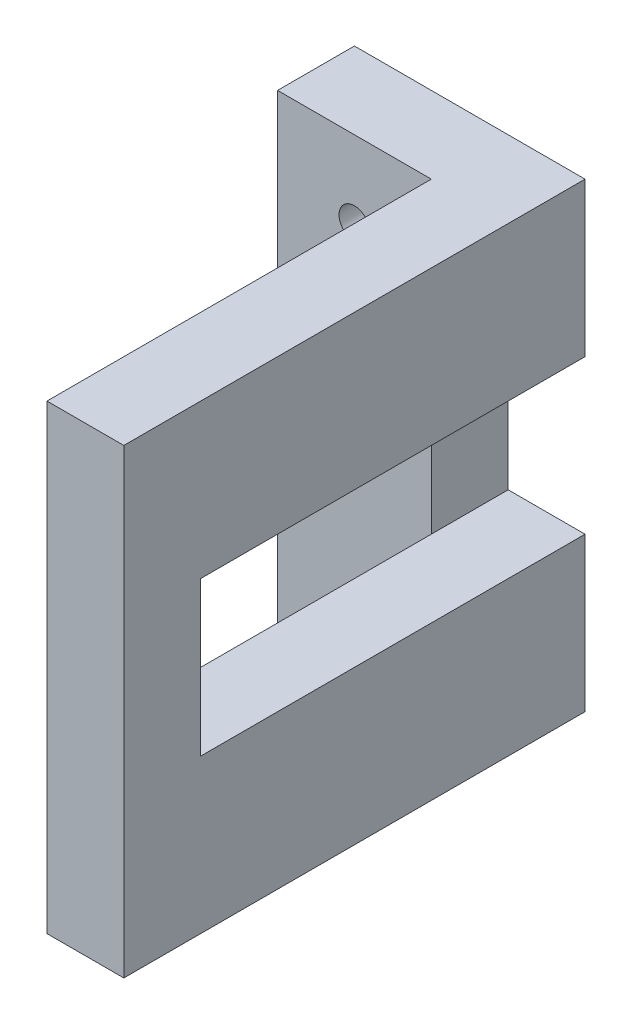
from build123d import *

# Parameters (mm, degrees)
SKETCH1_W           = 30
SKETCH1_H           = 60
BOSS_EXTRUDE1_DEPTH = 10
SKETCH2_W           = 10
SKETCH2_H           = 60
BOSS_EXTRUDE2_DEPTH = 50
SKETCH3_R           = 2
CUT_EXTRUDE1_DEPTH  = 50
SKETCH4_W           = 10
SKETCH4_H           = 20
CUT_EXTRUDE2_DEPTH  = 50


with BuildPart() as part:
    # Sketch1 → Boss-Extrude1 (new body)
    with BuildSketch(Plane.XY):
        with Locations((18.070175439, 2.280701754)):
            Rectangle(SKETCH1_W, SKETCH1_H)
    extrude(amount=BOSS_EXTRUDE1_DEPTH)

    # Sketch2 → Boss-Extrude2 (add)
    with BuildSketch(Plane.XY.offset(10)):
        with Locations((28.070175439, 2.280701754)):
            Rectangle(SKETCH2_W, SKETCH2_H)
    extrude(amount=BOSS_EXTRUDE2_DEPTH)

    # Sketch3 → Cut-Extrude1 (cut)
    with BuildSketch(Plane.XY.offset(10)):
        with Locations((13.070175439, 22.280701754)):
            Circle(SKETCH3_R)
        with Locations((13.070175439, 2.280701754)):
            Circle(SKETCH3_R)
    extrude(amount=-CUT_EXTRUDE1_DEPTH, mode=Mode.SUBTRACT)

    # Sketch4 → Cut-Extrude2 (cut)
    with BuildSketch(Plane(origin=(0, 0, 0), x_dir=(-1, 0, 0), z_dir=(0, 0, -1))):
        with Locations((-28.070175439, 2.280701754)):
            Rectangle(SKETCH4_W, SKETCH4_H)
    extrude(amount=-CUT_EXTRUDE2_DEPTH, mode=Mode.SUBTRACT)


solid = part.part
